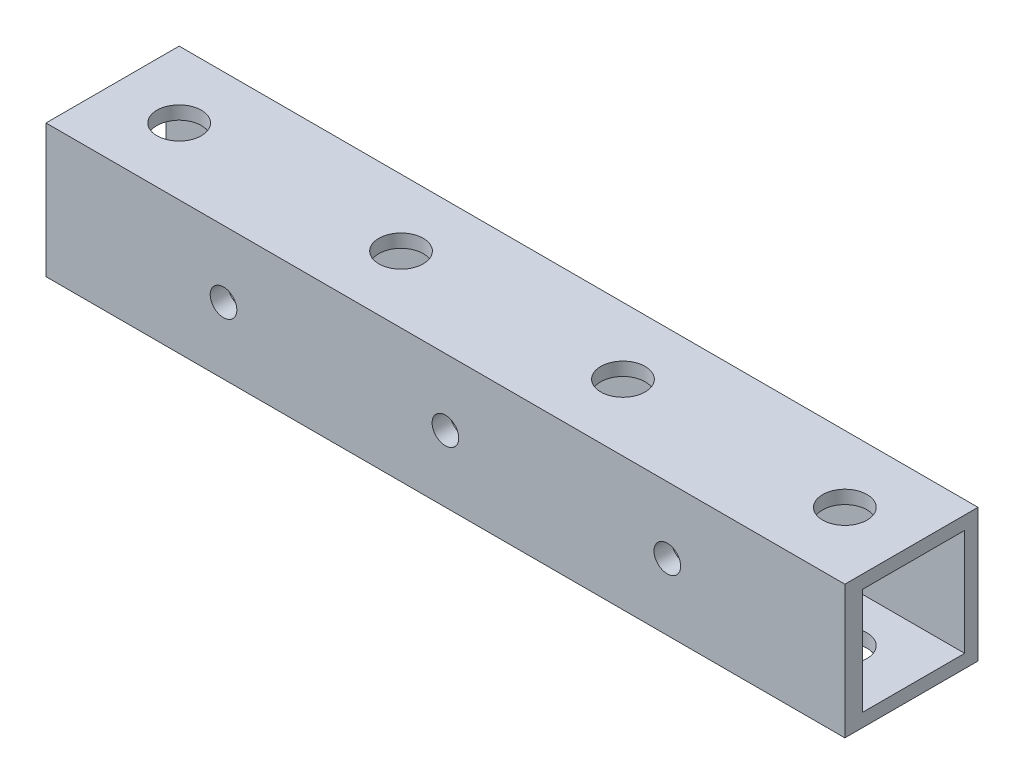
from build123d import *

# Parameters (mm, degrees)
MEMBER_15_15_1_5_1_DEPTH = 90
SKETCH_3_R               = 2.5
CUT_EXTRUDE_1_DEPTH      = 92.549167118
SKETCH_4_R               = 1.5
CUT_EXTRUDE_2_DEPTH      = 92.549167118


with BuildPart() as part:
    # Sketch1 → Member 15 _15_ 1.5_1 (new body)
    with BuildSketch(Plane(origin=(0, 0, 0), x_dir=(0, 0, -1), z_dir=(1, 0, 0))):
        Polygon((-6, -7.5), (6, -7.5), (7.5, -7.5), (7.5, -6), (7.5, 6), (7.5, 7.5), (6, 7.5), (-6, 7.5), (-7.5, 7.5), (-7.5, 6), (-7.5, -6), (-7.5, -7.5), align=None)
        Polygon((-4, -6), (4, -6), (6, -6), (6, -3.5), (6, 3.5), (6, 6), (3.5, 6), (-3.5, 6), (-5.5, 6), (-5.5, 3.5), (-5.5, -3.5), (-5.5, -6), align=None, mode=Mode.SUBTRACT)
    extrude(amount=MEMBER_15_15_1_5_1_DEPTH)

    # 草图3 → 切除-拉伸1 (cut, through all)
    with BuildSketch(Plane(origin=(0, 7.5, 0), x_dir=(1, 0, 0), z_dir=(0, 1, 0))):
        with Locations(Location((7.5, 0, 0), (0, 0, 270))):
            Circle(SKETCH_3_R)
        with Locations(Location((32.5, 0, 0), (0, 0, 270))):
            Circle(SKETCH_3_R)
        with Locations(Location((57.5, 0, 0), (0, 0, 270))):
            Circle(SKETCH_3_R)
        with Locations(Location((82.5, 0, 0), (0, 0, 270))):
            Circle(SKETCH_3_R)
    extrude(amount=-CUT_EXTRUDE_1_DEPTH, mode=Mode.SUBTRACT)

    # 草图4 → 切除-拉伸2 (cut, through all)
    with BuildSketch(Plane.XY.offset(7.5)):
        with Locations((45, 0)):
            Circle(SKETCH_4_R)
        with Locations((20, 0)):
            Circle(SKETCH_4_R)
        with Locations((70, 0)):
            Circle(SKETCH_4_R)
    extrude(amount=-CUT_EXTRUDE_2_DEPTH, mode=Mode.SUBTRACT)


solid = part.part
